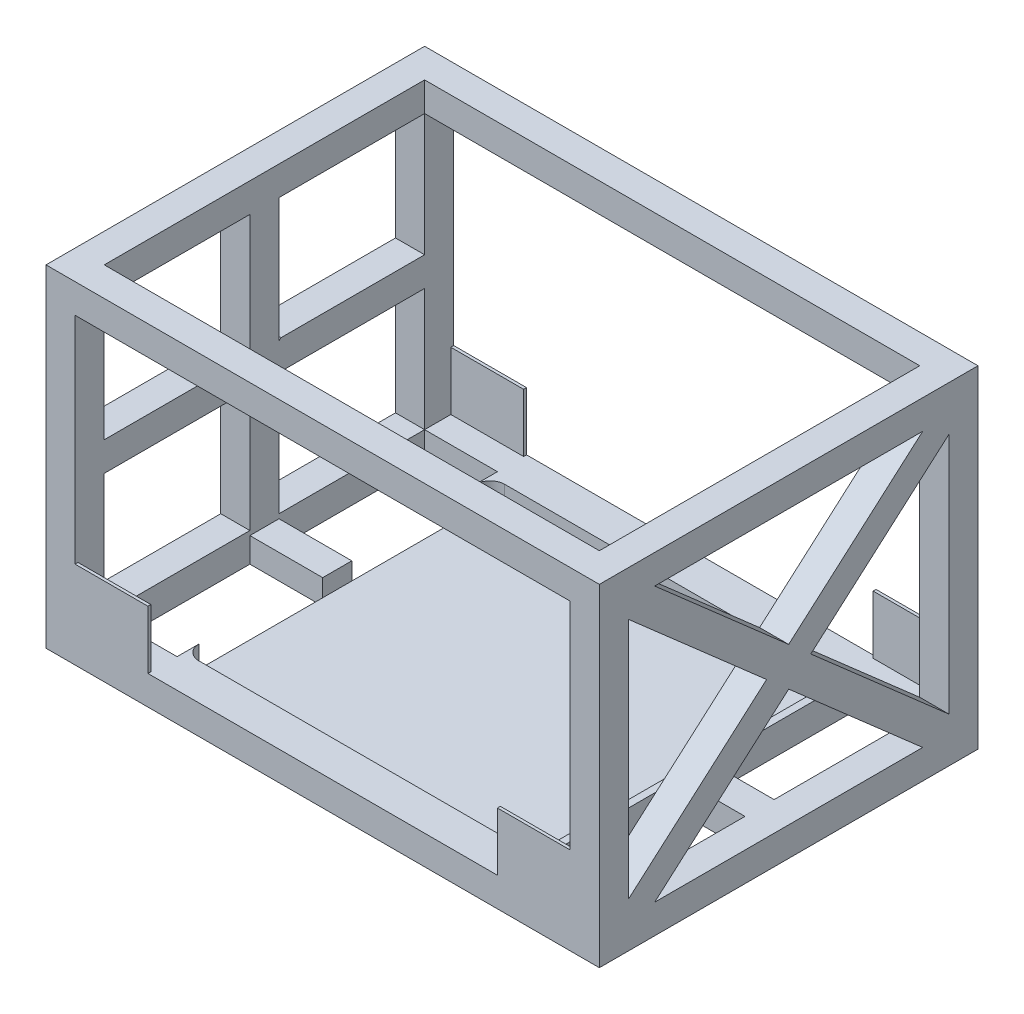
from build123d import *

# Parameters (mm, degrees)
SKETCH1_W            = 20
SKETCH1_H            = 260
BOSS_EXTRUDE1_DEPTH  = 10
CUT_EXTRUDE1_DEPTH   = 15
SKETCH3_W            = 10
SKETCH3_H            = 20
BOSS_EXTRUDE2_DEPTH  = 40
BOSS_EXTRUDE3_DEPTH  = 230
BOSS_EXTRUDE4_DEPTH  = 50
SKETCH6_W            = 260
SKETCH6_H            = 228
BOSS_EXTRUDE5_DEPTH  = 20
SKETCH7_W            = 20
SKETCH7_H            = 17
BOSS_EXTRUDE6_DEPTH  = 50
SKETCH8_W            = 20
SKETCH8_H            = 60
BOSS_EXTRUDE7_DEPTH  = 50
SKETCH9_W            = 20
SKETCH9_H            = 60
BOSS_EXTRUDE8_DEPTH  = 50
SKETCH10_W           = 20
SKETCH10_H           = 20
BOSS_EXTRUDE9_DEPTH  = 340
SKETCH11_W           = 20
SKETCH11_H           = 20
BOSS_EXTRUDE10_DEPTH = 340
SKETCH12_W           = 260
SKETCH12_H           = 228
BOSS_EXTRUDE11_DEPTH = 20
SKETCH13_W           = 40
SKETCH13_H           = 20
CUT_EXTRUDE2_DEPTH   = 240
SKETCH14_W           = 210
SKETCH14_H           = 15
CUT_EXTRUDE3_DEPTH   = 230
SKETCH15_W           = 100
SKETCH15_H           = 20
CUT_EXTRUDE4_DEPTH   = 45
SKETCH16_W           = 20
SKETCH16_H           = 100
CUT_EXTRUDE5_DEPTH   = 84
SKETCH17_W           = 20
SKETCH17_H           = 100
CUT_EXTRUDE6_DEPTH   = 84
SKETCH18_W           = 20
SKETCH18_H           = 84
CUT_EXTRUDE7_DEPTH   = 100
SKETCH19_W           = 100
SKETCH19_H           = 20
CUT_EXTRUDE8_DEPTH   = 45
CUT_EXTRUDE9_REACH   = 475.244
SKETCH20_W           = 50
SKETCH20_H           = 40
SKETCH21_W           = 50
SKETCH21_H           = 40
CUT_EXTRUDE10_DEPTH  = 18
CUT_EXTRUDE11_REACH  = 475.244
SKETCH22_W           = 50
SKETCH22_H           = 40
SKETCH23_W           = 50
SKETCH23_H           = 40
CUT_EXTRUDE12_DEPTH  = 18
CUT_EXTRUDE13_DEPTH  = 400.369503092
CUT_EXTRUDE14_DEPTH  = 400.369503092
CUT_EXTRUDE15_REACH  = 419.488
FILLET1_R            = 10


with BuildPart() as part:
    # Sketch1 → Boss-Extrude1 (new body)
    with BuildSketch(Plane(origin=(70, 0, 0), x_dir=(0, -1, 0), z_dir=(-1, 0, 0))):
        with Locations((104, 0)):
            Rectangle(SKETCH1_W, SKETCH1_H)
    extrude(amount=-BOSS_EXTRUDE1_DEPTH)

    # Sketch2 → Cut-Extrude1 (cut)
    with BuildSketch(Plane(origin=(0, -94, 0), x_dir=(-1, 0, 0), z_dir=(0, 1, 0))):
        with BuildLine():
            Line((-80, 105), (-80, -105))
            ThreePointArc((-80, -105), (-72.928932188, -102.071067812), (-70, -95))
            Line((-70, -95), (-70, 95))
            ThreePointArc((-70, 95), (-72.928932188, 102.071067812), (-80, 105))
        make_face()
    extrude(amount=-CUT_EXTRUDE1_DEPTH, mode=Mode.SUBTRACT)

    # Sketch3 → Boss-Extrude2 (add)
    with BuildSketch(Plane(origin=(0, -94, 0), x_dir=(-1, 0, 0), z_dir=(0, 1, 0))):
        with Locations((-75, -120)):
            Rectangle(SKETCH3_W, SKETCH3_H)
    extrude(amount=BOSS_EXTRUDE2_DEPTH)

    # Sketch4 → Boss-Extrude3 (add)
    with BuildSketch(Plane(origin=(80, 0, 0), x_dir=(0, 0, -1), z_dir=(1, 0, 0))):
        Polygon((-130, -114), (-130, -94), (110, -94), (110, -54), (130, -54), (130, -114), align=None)
    extrude(amount=BOSS_EXTRUDE3_DEPTH)

    # Sketch5 → Boss-Extrude4 (add)
    with BuildSketch(Plane(origin=(310, 0, 0), x_dir=(0, 0, -1), z_dir=(1, 0, 0))):
        Polygon((110, -94), (110, -54), (130, -54), (130, -114), (-130, -114), (-130, -54), (-110, -54), (-110, -94), align=None)
    extrude(amount=BOSS_EXTRUDE4_DEPTH)

    # Sketch6 → Boss-Extrude5 (add)
    with BuildSketch(Plane(origin=(360, 0, 0), x_dir=(0, 0, -1), z_dir=(1, 0, 0))):
        Rectangle(SKETCH6_W, SKETCH6_H)
        Polygon((92.025912459, -94), (0, -13.30035369), (-92.025912459, -94), align=None, mode=Mode.SUBTRACT)
    extrude(amount=BOSS_EXTRUDE5_DEPTH)

    # Sketch7 → Boss-Extrude6 (add)
    with BuildSketch(Plane.ZY.offset(-70)):
        with Locations((0, -105.5)):
            Rectangle(SKETCH7_W, SKETCH7_H)
    extrude(amount=BOSS_EXTRUDE6_DEPTH)

    # Sketch8 → Boss-Extrude7 (add)
    with BuildSketch(Plane.ZY.offset(-70)):
        with Locations((120, -84)):
            Rectangle(SKETCH8_W, SKETCH8_H)
    extrude(amount=BOSS_EXTRUDE7_DEPTH)

    # Sketch9 → Boss-Extrude8 (add)
    with BuildSketch(Plane.ZY.offset(-70)):
        with Locations((-120, -84)):
            Rectangle(SKETCH9_W, SKETCH9_H)
    extrude(amount=BOSS_EXTRUDE8_DEPTH)

    # Sketch10 → Boss-Extrude9 (add)
    with BuildSketch(Plane.ZY.offset(-360)):
        with Locations((-120, 104)):
            Rectangle(SKETCH10_W, SKETCH10_H)
    extrude(amount=BOSS_EXTRUDE9_DEPTH)

    # Sketch11 → Boss-Extrude10 (add)
    with BuildSketch(Plane.ZY.offset(-360)):
        with Locations((120, 104)):
            Rectangle(SKETCH11_W, SKETCH11_H)
    extrude(amount=BOSS_EXTRUDE10_DEPTH)

    # Sketch12 → Boss-Extrude11 (add)
    with BuildSketch(Plane(origin=(20, 0, 0), x_dir=(0, 0, -1), z_dir=(1, 0, 0))):
        Rectangle(SKETCH12_W, SKETCH12_H)
        Polygon((10, 8.769230769), (10, 10), (11.403508772, 10), align=None, mode=Mode.SUBTRACT)
        Polygon((-10, -94), (-110, -94), (-110, -10), (-11.403508772, -10), (-10, -8.769230769), align=None, mode=Mode.SUBTRACT)
    extrude(amount=-BOSS_EXTRUDE11_DEPTH)

    # Sketch13 → Cut-Extrude2 (cut)
    with BuildSketch(Plane(origin=(70, 0, 0), x_dir=(0, -1, 0), z_dir=(-1, 0, 0))):
        with Locations((74, -120)):
            Rectangle(SKETCH13_W, SKETCH13_H)
    extrude(amount=-CUT_EXTRUDE2_DEPTH, mode=Mode.SUBTRACT)

    # Sketch14 → Cut-Extrude3 (cut)
    with BuildSketch(Plane.ZY.offset(-80)):
        with Locations((0, -101.5)):
            Rectangle(SKETCH14_W, SKETCH14_H)
    extrude(amount=-CUT_EXTRUDE3_DEPTH, mode=Mode.SUBTRACT)

    # Sketch15 → Cut-Extrude4 (cut)
    with BuildSketch(Plane(origin=(360, 0, 0), x_dir=(0, 0, -1), z_dir=(1, 0, 0))):
        with Locations((60, -104)):
            Rectangle(SKETCH15_W, SKETCH15_H)
    extrude(amount=-CUT_EXTRUDE4_DEPTH, mode=Mode.SUBTRACT)

    # Sketch16 → Cut-Extrude5 (cut)
    with BuildSketch(Plane.XZ.offset(-10)):
        with Locations((10, 60)):
            Rectangle(SKETCH16_W, SKETCH16_H)
    extrude(amount=-CUT_EXTRUDE5_DEPTH, mode=Mode.SUBTRACT)

    # Sketch17 → Cut-Extrude6 (cut)
    with BuildSketch(Plane.XZ.offset(-10)):
        with Locations((10, -60)):
            Rectangle(SKETCH17_W, SKETCH17_H)
    extrude(amount=-CUT_EXTRUDE6_DEPTH, mode=Mode.SUBTRACT)

    # Sketch18 → Cut-Extrude7 (cut)
    with BuildSketch(Plane(origin=(0, 0, -110), x_dir=(-1, 0, 0), z_dir=(0, 0, -1))):
        with Locations((-10, -52)):
            Rectangle(SKETCH18_W, SKETCH18_H)
    extrude(amount=-CUT_EXTRUDE7_DEPTH, mode=Mode.SUBTRACT)

    # Sketch19 → Cut-Extrude8 (cut)
    with BuildSketch(Plane(origin=(360, 0, 0), x_dir=(0, 0, -1), z_dir=(1, 0, 0))):
        with Locations((-60, -104)):
            Rectangle(SKETCH19_W, SKETCH19_H)
    extrude(amount=-CUT_EXTRUDE8_DEPTH, mode=Mode.SUBTRACT)

    # Sketch20 → Cut-Extrude9 (cut, up to next)
    with BuildSketch(Plane(origin=(0, 0, -128), x_dir=(-1, 0, 0), z_dir=(0, 0, -1)), mode=Mode.PRIVATE) as cut_extrude9_sk1:
        with Locations((-45, -74)):
            Rectangle(SKETCH20_W, SKETCH20_H)
    cut_extrude9_tool1 = extrude(cut_extrude9_sk1.sketch, amount=-CUT_EXTRUDE9_REACH, mode=Mode.PRIVATE) & part.part
    add(cut_extrude9_tool1.solids().sort_by_distance((45, -74, -128))[0], mode=Mode.SUBTRACT)

    # Sketch21 → Cut-Extrude10 (cut)
    with BuildSketch(Plane.XY.offset(-110)):
        with Locations((335, -74)):
            Rectangle(SKETCH21_W, SKETCH21_H)
    extrude(amount=-CUT_EXTRUDE10_DEPTH, mode=Mode.SUBTRACT)

    # Sketch22 → Cut-Extrude11 (cut, up to next)
    with BuildSketch(Plane.XY.offset(128), mode=Mode.PRIVATE) as cut_extrude11_sk1:
        with Locations((45, -74)):
            Rectangle(SKETCH22_W, SKETCH22_H)
    cut_extrude11_tool1 = extrude(cut_extrude11_sk1.sketch, amount=-CUT_EXTRUDE11_REACH, mode=Mode.PRIVATE) & part.part
    add(cut_extrude11_tool1.solids().sort_by_distance((45, -74, 128))[0], mode=Mode.SUBTRACT)

    # Sketch23 → Cut-Extrude12 (cut)
    with BuildSketch(Plane(origin=(0, 0, 110), x_dir=(-1, 0, 0), z_dir=(0, 0, -1))):
        with Locations((-335, -74)):
            Rectangle(SKETCH23_W, SKETCH23_H)
    extrude(amount=-CUT_EXTRUDE12_DEPTH, mode=Mode.SUBTRACT)

    # Sketch24 → Cut-Extrude13 (cut, through all)
    with BuildSketch(Plane.ZY.offset(-360)):
        Polygon((-92.025912459, 94), (0, 13.30035369), (92.025912459, 94), align=None)
    extrude(amount=-CUT_EXTRUDE13_DEPTH, mode=Mode.SUBTRACT)

    # Sketch25 → Cut-Extrude14 (cut, through all)
    with BuildSketch(Plane.ZY.offset(-360)):
        Polygon((110, 83.161184771), (15.167069998, 0), (110, -83.161184771), align=None)
    extrude(amount=-CUT_EXTRUDE14_DEPTH, mode=Mode.SUBTRACT)

    # Sketch26 → Cut-Extrude15 (cut, up to next)
    with BuildSketch(Plane(origin=(380, 0, 0), x_dir=(0, 0, -1), z_dir=(1, 0, 0)), mode=Mode.PRIVATE) as cut_extrude15_sk1:
        Polygon((15.167069998, 0), (110, -83.161184771), (110, 83.161184771), align=None)
    cut_extrude15_tool1 = extrude(cut_extrude15_sk1.sketch, amount=-CUT_EXTRUDE15_REACH, mode=Mode.PRIVATE) & part.part
    add(cut_extrude15_tool1.solids().sort_by_distance((380, 0, -78.389023))[0], mode=Mode.SUBTRACT)

    # Fillet1
    fillet1_edges = [part.edges().sort_by_distance(p)[0] for p in [
        (310, -101.5, -105),
        (310, -101.5, 105),
    ]]
    fillet(fillet1_edges, radius=FILLET1_R)


solid = part.part
